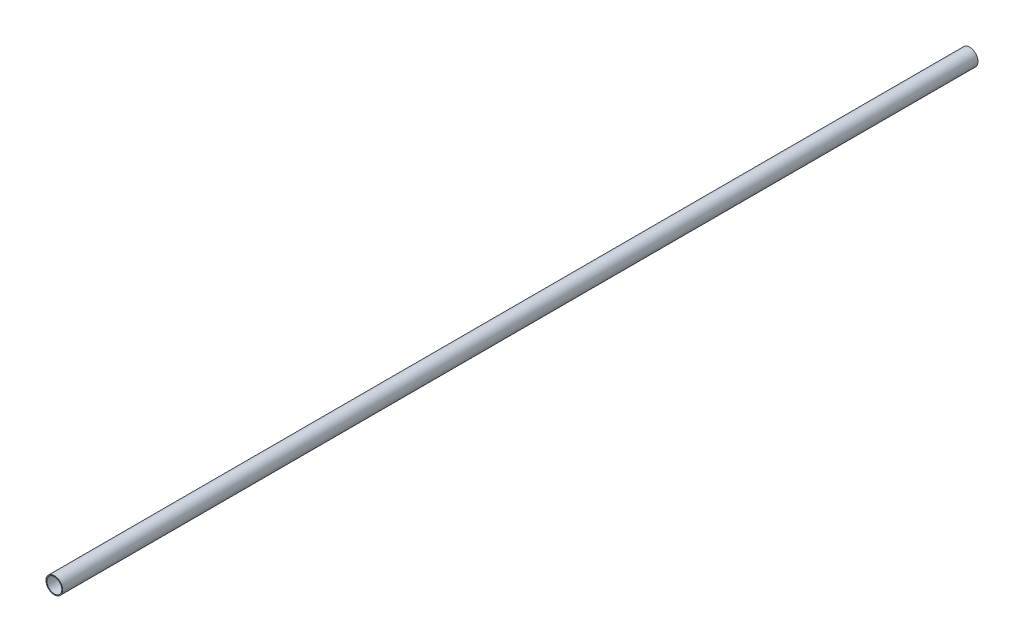
from build123d import *

# Parameters (mm, degrees)
SKETCH1_R           = 12.7
SKETCH1_R_2         = 11.4554
BOSS_EXTRUDE1_DEPTH = 1397


with BuildPart() as part:
    # Sketch1 → Boss-Extrude1 (new body)
    with BuildSketch(Plane.XY):
        Circle(SKETCH1_R)
        Circle(SKETCH1_R_2, mode=Mode.SUBTRACT)
    extrude(amount=BOSS_EXTRUDE1_DEPTH)


solid = part.part
